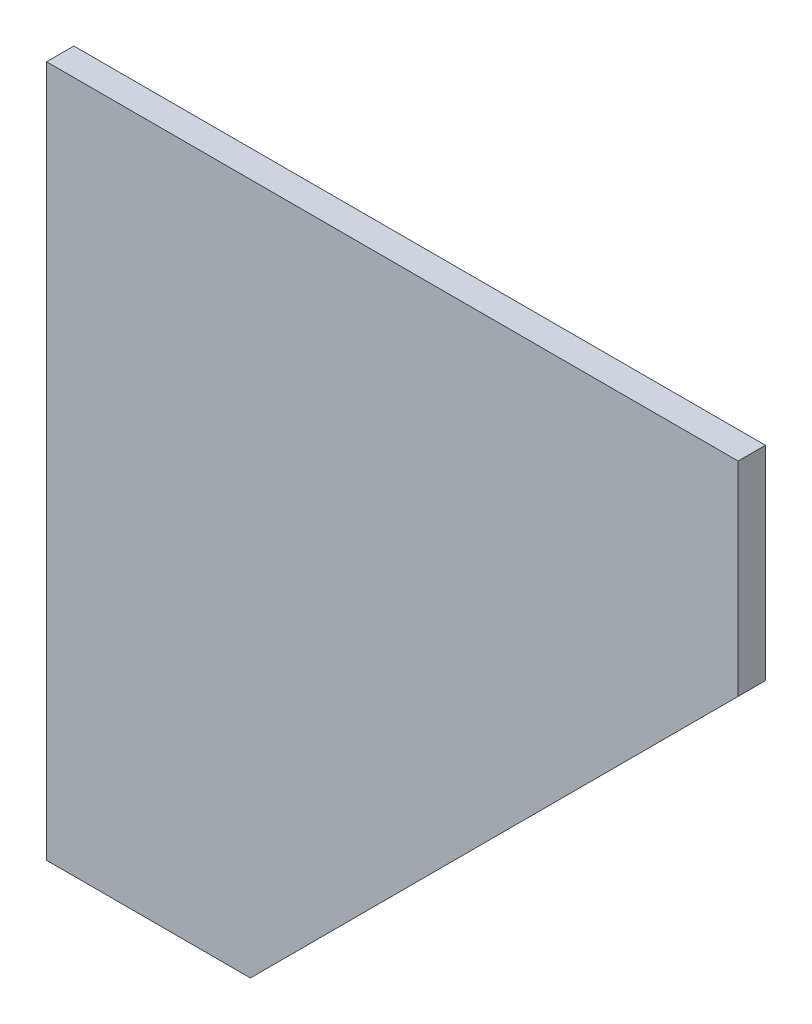
from build123d import *

# Parameters (mm, degrees)
SKETCH1_W           = 301.625
SKETCH1_H           = 301.625
BOSS_EXTRUDE1_DEPTH = 11.90625
CHAMFER1_SIZE       = 212.725


with BuildPart() as part:
    # Sketch1 → Boss-Extrude1 (new body)
    with BuildSketch(Plane.XY):
        Rectangle(SKETCH1_W, SKETCH1_H)
    extrude(amount=BOSS_EXTRUDE1_DEPTH)

    # Chamfer1
    chamfer1_edges = [part.edges().sort_by_distance(p)[0] for p in [
        (150.8125, -150.8125, 5.953125),
    ]]
    chamfer(chamfer1_edges, length=CHAMFER1_SIZE)


solid = part.part
